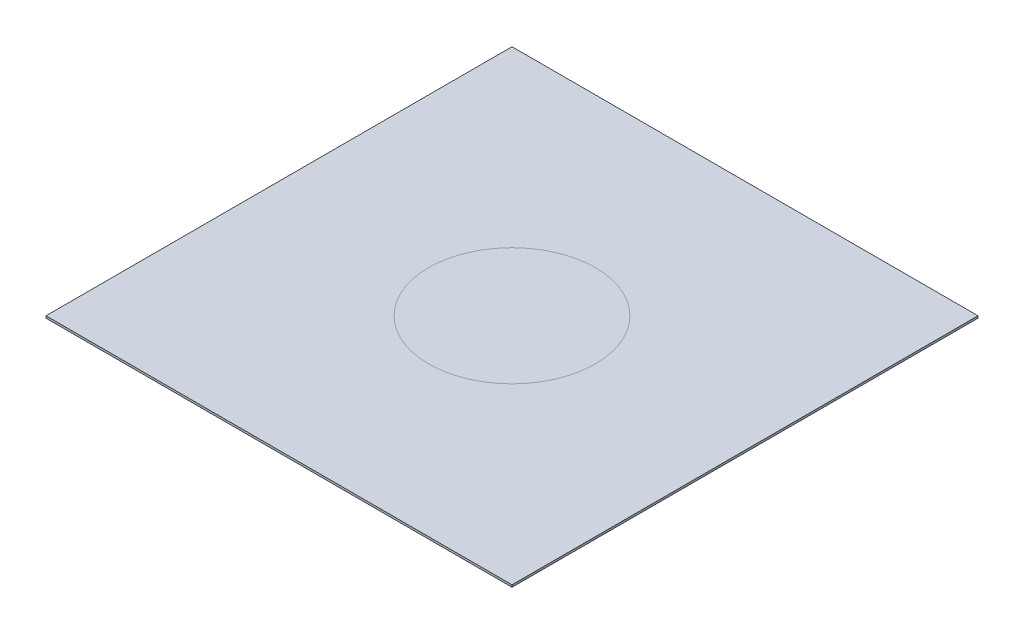
from build123d import *

# Parameters (mm, degrees)
SKETCH1_W           = 139.7
SKETCH1_H           = 139.7
BOSS_EXTRUDE1_DEPTH = 0.32


with BuildPart() as part:
    # Sketch1 → Boss-Extrude1 (new, symmetric)
    with BuildSketch(Plane(origin=(0, 0, 0), x_dir=(1, 0, 0), z_dir=(0, 1, 0))):
        Rectangle(SKETCH1_W, SKETCH1_H)
    extrude(amount=BOSS_EXTRUDE1_DEPTH, both=True)


solid = part.part
